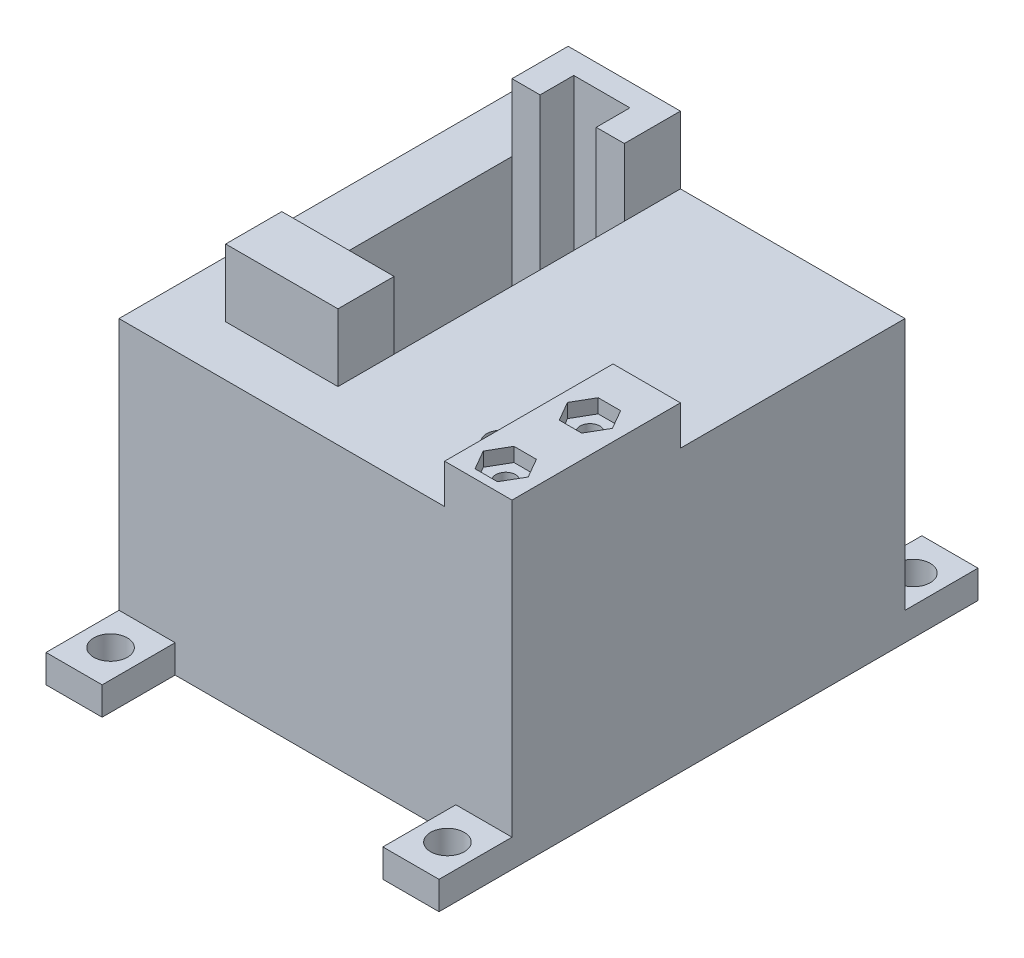
from build123d import *

# Parameters (mm, degrees)
SKETCH1_W           = 70
SKETCH1_H           = 70
BOSS_EXTRUDE1_DEPTH = 50
CUT_EXTRUDE1_DEPTH  = 40
SKETCH3_W           = 20
SKETCH3_H           = 41
CUT_EXTRUDE2_DEPTH  = 40
SKETCH4_W           = 12
SKETCH4_H           = 30
BOSS_EXTRUDE2_DEPTH = 7
CUT_EXTRUDE3_DEPTH  = 2.5
SKETCH7_R           = 2.5
CUT_EXTRUDE4_DEPTH  = 52.5
SKETCH10_W          = 10
SKETCH10_H          = 6
CUT_EXTRUDE6_DEPTH  = 55
SKETCH11_W          = 20
SKETCH11_H          = 10
BOSS_EXTRUDE3_DEPTH = 12
SKETCH13_W          = 10
SKETCH13_H          = 5
BOSS_EXTRUDE4_DEPTH = 13
SKETCH14_W          = 10
SKETCH14_H          = 5
BOSS_EXTRUDE5_DEPTH = 13
SKETCH15_R          = 3
CUT_EXTRUDE7_DEPTH  = 33
CUT_EXTRUDE8_DEPTH  = 10
SKETCH18_R          = 1.75
CUT_EXTRUDE9_DEPTH  = 20


with BuildPart() as part:
    # Sketch1 → Boss-Extrude1 (new body)
    with BuildSketch(Plane(origin=(0, 0, 0), x_dir=(1, 0, 0), z_dir=(0, 1, 0))):
        Rectangle(SKETCH1_W, SKETCH1_H)
    extrude(amount=BOSS_EXTRUDE1_DEPTH)

    # Sketch2 → Cut-Extrude1 (cut)
    with BuildSketch(Plane.XZ):
        Polygon((0, 25), (-25, 25), (-25, -25), (25, -25), (25, 25), align=None)
    extrude(amount=-CUT_EXTRUDE1_DEPTH, mode=Mode.SUBTRACT)

    # Sketch3 → Cut-Extrude2 (cut)
    with BuildSketch(Plane(origin=(0, 50, 0), x_dir=(1, 0, 0), z_dir=(0, 1, 0))):
        with Locations((-15, 4.5)):
            Rectangle(SKETCH3_W, SKETCH3_H)
    extrude(amount=-CUT_EXTRUDE2_DEPTH, mode=Mode.SUBTRACT)

    # Sketch4 → Boss-Extrude2 (add)
    with BuildSketch(Plane(origin=(0, 50, 0), x_dir=(1, 0, 0), z_dir=(0, 1, 0))):
        with Locations((29, -20)):
            Rectangle(SKETCH4_W, SKETCH4_H)
    extrude(amount=BOSS_EXTRUDE2_DEPTH)

    # Sketch5 → Cut-Extrude3 (cut)
    with BuildSketch(Plane(origin=(0, 57, 0), x_dir=(1, 0, 0), z_dir=(0, 1, 0))):
        Polygon((32.881686691, -15), (30.881686691, -18.464101615), (26.881686691, -18.464101615), (24.881686691, -15), (26.881686691, -11.535898385), (30.881686691, -11.535898385), align=None)
        Polygon((26.881686691, -33.464101615), (24.881686691, -30), (26.881686691, -26.535898385), (30.881686691, -26.535898385), (32.881686691, -30), (30.881686691, -33.464101615), align=None)
    extrude(amount=-CUT_EXTRUDE3_DEPTH, mode=Mode.SUBTRACT)

    # Sketch7 → Cut-Extrude4 (cut)
    with BuildSketch(Plane(origin=(0, 50, 0), x_dir=(1, 0, 0), z_dir=(0, 1, 0))):
        with Locations(Location((18, -20, 0), (0, 0, 270))):
            Circle(SKETCH7_R)
    extrude(amount=-CUT_EXTRUDE4_DEPTH, mode=Mode.SUBTRACT)

    # Sketch10 → Cut-Extrude6 (cut)
    with BuildSketch(Plane.XZ):
        with Locations((-15, -28)):
            Rectangle(SKETCH10_W, SKETCH10_H)
    extrude(amount=-CUT_EXTRUDE6_DEPTH, mode=Mode.SUBTRACT)

    # Sketch11 → Boss-Extrude3 (add)
    with BuildSketch(Plane(origin=(0, 50, 0), x_dir=(1, 0, 0), z_dir=(0, 1, 0))):
        Polygon((-25, 35), (-25, 25), (-20, 25), (-20, 31), (-10, 31), (-10, 25), (-5, 25), (-5, 35), align=None)
        with Locations((-15, -21)):
            Rectangle(SKETCH11_W, SKETCH11_H)
    extrude(amount=BOSS_EXTRUDE3_DEPTH)

    # Sketch13 → Boss-Extrude4 (add)
    with BuildSketch(Plane.XY.offset(35)):
        with Locations((-30, 2.5)):
            Rectangle(SKETCH13_W, SKETCH13_H)
        with Locations((30, 2.5)):
            Rectangle(SKETCH13_W, SKETCH13_H)
    extrude(amount=BOSS_EXTRUDE4_DEPTH)

    # Sketch14 → Boss-Extrude5 (add)
    with BuildSketch(Plane(origin=(0, 0, -35), x_dir=(-1, 0, 0), z_dir=(0, 0, -1))):
        with Locations((-30, 2.5)):
            Rectangle(SKETCH14_W, SKETCH14_H)
        with Locations((30, 2.5)):
            Rectangle(SKETCH14_W, SKETCH14_H)
    extrude(amount=BOSS_EXTRUDE5_DEPTH)

    # Sketch15 → Cut-Extrude7 (cut)
    with BuildSketch(Plane(origin=(0, 5, 0), x_dir=(1, 0, 0), z_dir=(0, 1, 0))):
        with Locations(Location((-29.888443239, 41.354976211, 0), (0, 0, 180))):
            Circle(SKETCH15_R)
        with Locations(Location((-30, -41.5, 0), (0, 0, 180))):
            Circle(SKETCH15_R)
        with Locations(Location((30, -41.5, 0), (0, 0, 180))):
            Circle(SKETCH15_R)
        with Locations(Location((30, 41.5, 0), (0, 0, 180))):
            Circle(SKETCH15_R)
    extrude(amount=-CUT_EXTRUDE7_DEPTH, mode=Mode.SUBTRACT)

    # Sketch16 → Cut-Extrude8 (cut)
    with BuildSketch(Plane.ZY.offset(35)):
        Polygon((-10, 0), (-10, 10), (-15, 10), (-20, 10), (-20, 0), align=None)
    extrude(amount=-CUT_EXTRUDE8_DEPTH, mode=Mode.SUBTRACT)

    # Sketch18 → Cut-Extrude9 (cut)
    with BuildSketch(Plane(origin=(0, 54.5, 0), x_dir=(1, 0, 0), z_dir=(0, 1, 0))):
        with Locations(Location((28.881686691, -15, 0), (0, 0, 270))):
            Circle(SKETCH18_R)
        with Locations(Location((28.881686691, -30, 0), (0, 0, 270))):
            Circle(SKETCH18_R)
    extrude(amount=-CUT_EXTRUDE9_DEPTH, mode=Mode.SUBTRACT)


solid = part.part
